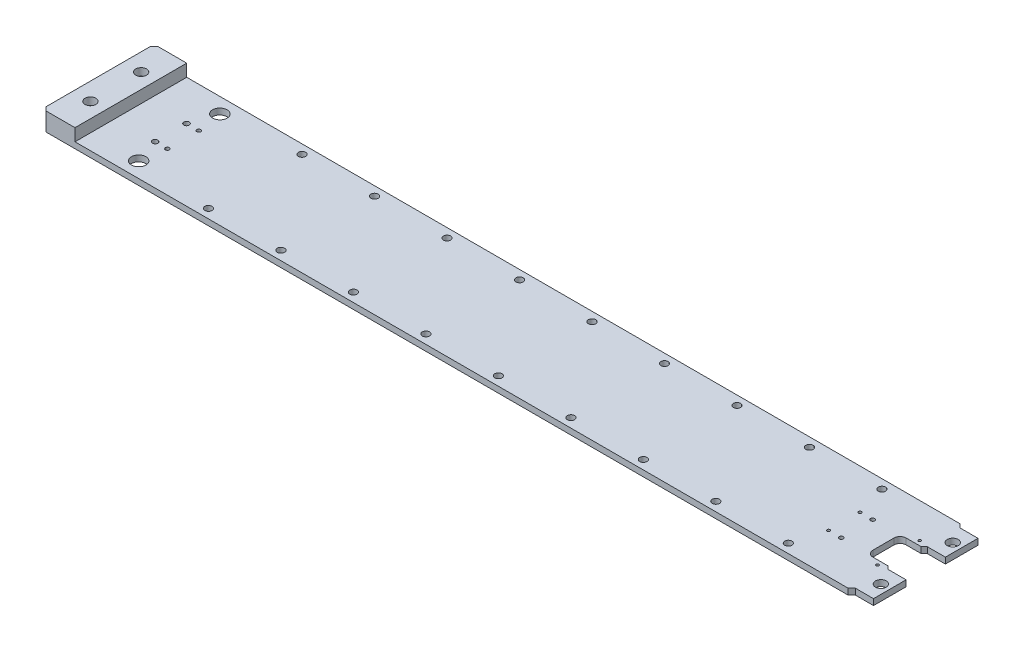
from build123d import *

# Parameters (mm, degrees)
SKETCH1_W                                       = 560
SKETCH1_H                                       = 185
BOSS_EXTRUDE1_DEPTH                             = 10
CBORE_FOR_M6_SOCKET_HEAD_CAP_SCREW1_D           = 6.6
CBORE_FOR_M6_SOCKET_HEAD_CAP_SCREW1_CBORE_D     = 11
CBORE_FOR_M6_SOCKET_HEAD_CAP_SCREW1_CBORE_DEPTH = 6
SKETCH4_W                                       = 40
SKETCH4_H                                       = 55
CUT_EXTRUDE1_DEPTH                              = 340.497422671
FILLET1_R                                       = 10
CHAMFER1_SIZE                                   = 5
CBORE_FOR_M4_SOCKET_HEAD_CAP_SCREW1_D           = 4.5
CBORE_FOR_M4_SOCKET_HEAD_CAP_SCREW1_CBORE_D     = 8
CBORE_FOR_M4_SOCKET_HEAD_CAP_SCREW1_CBORE_DEPTH = 5
M8X1_25_TAPPED_HOLE1_D                          = 6.8
M6X1_0_TAPPED_HOLE1_D                           = 5
M6X1_0_TAPPED_HOLE1_DEPTH                       = 17
M6X1_0_TAPPED_HOLE1_TIP                         = 1.502151548
CBORE_FOR_M5_SOCKET_HEAD_CAP_SCREW1_D           = 5.5
CBORE_FOR_M5_SOCKET_HEAD_CAP_SCREW1_CBORE_D     = 10
CBORE_FOR_M5_SOCKET_HEAD_CAP_SCREW1_CBORE_DEPTH = 5
LPATTERN2_COUNT                                 = 2
LPATTERN2_PITCH                                 = 250
LPATTERN2_COUNT_DIR2                            = 2
LPATTERN2_PITCH_DIR2                            = 100
SCALE1_SCALE                                    = 0.16666666
SKETCH17_W                                      = 30.8333321
SKETCH17_H                                      = 1.6666666
BOSS_EXTRUDE3_DEPTH                             = 130
CHAMFER2_SIZE                                   = 1
CUT_EXTRUDE3_REACH                              = 137.654
SKETCH19_R                                      = 0.74999997
CUT_EXTRUDE4_REACH                              = 137.654
SKETCH20_R                                      = 0.541666645
BOSS_EXTRUDE4_DEPTH                             = 3.38
SKETCH23_W                                      = 8.9999996
SKETCH23_H                                      = 1.6666666
BOSS_EXTRUDE5_DEPTH                             = 5
CUT_EXTRUDE5_REACH                              = 137.686
SKETCH24_R                                      = 1.5
CUT_EXTRUDE6_REACH                              = 137.738
SKETCH25_R                                      = 1.5
SKETCH26_R                                      = 2.75
CUT_EXTRUDE7_DEPTH                              = 3
SKETCH27_R                                      = 0.8333333
SKETCH27_R_2                                    = 0.41666665
SKETCH27_R_3                                    = 0.566666644
BOSS_EXTRUDE7_DEPTH                             = 1.6666666
SKETCH28_R                                      = 0.8333333
SKETCH28_R_2                                    = 0.91666663
BOSS_EXTRUDE8_DEPTH                             = 1.6666666
CUT_EXTRUDE8_REACH                              = 137.686
SKETCH29_R                                      = 1
BOSS_EXTRUDE9_START                             = -1.6666666
SKETCH31_R                                      = 1
BOSS_EXTRUDE9_DEPTH                             = 1.6666666
CUT_EXTRUDE9_REACH                              = 137.686
SKETCH33_R                                      = 2


with BuildPart() as part:
    # Sketch1 → Boss-Extrude1 (new body)
    with BuildSketch(Plane(origin=(0, 0, 0), x_dir=(1, 0, 0), z_dir=(0, 1, 0))):
        with Locations((46.5, 0)):
            Rectangle(SKETCH1_W, SKETCH1_H)
    extrude(amount=BOSS_EXTRUDE1_DEPTH)

    # CBORE for M6 Socket Head Cap Screw1 (through all)
    with Locations(Plane(origin=(0, 10, 0), x_dir=(-1, 0, 0), z_dir=(0, 1, 0))):
        with Locations((26, 44.5), (26, 64.5), (-26, 44.5), (-26, 64.5)):
            CounterBoreHole(CBORE_FOR_M6_SOCKET_HEAD_CAP_SCREW1_D / 2, CBORE_FOR_M6_SOCKET_HEAD_CAP_SCREW1_CBORE_D / 2, CBORE_FOR_M6_SOCKET_HEAD_CAP_SCREW1_CBORE_DEPTH)

    # Sketch4 → Cut-Extrude1 (cut, through all)
    with BuildSketch(Plane(origin=(0, 10, 0), x_dir=(1, 0, 0), z_dir=(0, 1, 0))):
        with Locations((306.5, 0)):
            Rectangle(SKETCH4_W, SKETCH4_H)
    extrude(amount=-CUT_EXTRUDE1_DEPTH, mode=Mode.SUBTRACT)

    # Fillet1
    fillet1_edges = [part.edges().sort_by_distance(p)[0] for p in [
        (286.5, 5, 27.5),
        (286.5, 5, -27.5),
    ]]
    fillet(fillet1_edges, radius=FILLET1_R)

    # Chamfer1
    chamfer1_edges = [part.edges().sort_by_distance(p)[0] for p in [
        (326.5, 5, -27.5),
        (326.5, 5, 27.5),
    ]]
    chamfer(chamfer1_edges, length=CHAMFER1_SIZE)

    # CBORE for M4 Socket Head Cap Screw1 (through all)
    with Locations(Plane.XZ):
        with Locations((311.5, 35), (311.5, -35)):
            CounterBoreHole(CBORE_FOR_M4_SOCKET_HEAD_CAP_SCREW1_D / 2, CBORE_FOR_M4_SOCKET_HEAD_CAP_SCREW1_CBORE_D / 2, CBORE_FOR_M4_SOCKET_HEAD_CAP_SCREW1_CBORE_DEPTH)

    # M8x1.25 Tapped Hole1 (through all)
    with Locations(Plane(origin=(0, 10, 0), x_dir=(-1, 0, 0), z_dir=(0, 1, 0))):
        with Locations((-242.5, 26), (-242.5, -26), (162, 26), (162, -26)):
            Hole(M8X1_25_TAPPED_HOLE1_D / 2)

    # M6x1.0 Tapped Hole1
    with Locations(Plane(origin=(0, 10, 0), x_dir=(-1, 0, 0), z_dir=(0, 1, 0))):
        with Locations((143, 26), (143, -26), (-221.5, 26), (-221.5, -26)):
            Hole(M6X1_0_TAPPED_HOLE1_D / 2, depth=M6X1_0_TAPPED_HOLE1_DEPTH)
            with Locations((0, 0, -(M6X1_0_TAPPED_HOLE1_DEPTH + M6X1_0_TAPPED_HOLE1_TIP / 2))):  # 118° drill point
                Cone(0, M6X1_0_TAPPED_HOLE1_D / 2, M6X1_0_TAPPED_HOLE1_TIP, mode=Mode.SUBTRACT)

    # CBORE for M5 Socket Head Cap Screw1 (through all)
    with Locations(Plane(origin=(0, 10, 0), x_dir=(-1, 0, 0), z_dir=(0, 1, 0))):
        with Locations((-109, 50), (-141, 50)):
            cbore_for_m5_socket_head_cap_screw1 = CounterBoreHole(CBORE_FOR_M5_SOCKET_HEAD_CAP_SCREW1_D / 2, CBORE_FOR_M5_SOCKET_HEAD_CAP_SCREW1_CBORE_D / 2, CBORE_FOR_M5_SOCKET_HEAD_CAP_SCREW1_CBORE_DEPTH)

    # Lpattern2: CBORE for M5 Socket Head Cap Screw1 2 × 2
    with Locations(*[(-i * LPATTERN2_PITCH, 0, -j * LPATTERN2_PITCH_DIR2) for i in range(LPATTERN2_COUNT) for j in range(LPATTERN2_COUNT_DIR2) if (i, j) != (0, 0)]):
        add(cbore_for_m5_socket_head_cap_screw1, mode=Mode.SUBTRACT)


with BuildPart() as part_1:
    # Scale1: scaled about (40.999570981, 4.992494178, -0.153467199)
    add(part.part.scale(SCALE1_SCALE).moved(Location((34.166309424, 4.160411848, -0.127889334))))

    # Sketch17 → Boss-Extrude3 (add)
    with BuildSketch(Plane.ZY.offset(4.750355686)):
        with Locations((-0.127889333, 4.993745148)):
            Rectangle(SKETCH17_W, SKETCH17_H)
    extrude(amount=BOSS_EXTRUDE3_DEPTH)

    # Chamfer2
    chamfer2_edges = [part_1.edges().sort_by_distance(p)[0] for p in [
        (-134.750355686, 4.993745148, -15.544555383),
        (-134.750355686, 4.993745148, 15.288776717),
        (88.582973914, 4.993745148, -15.544555384),
        (88.582973914, 4.993745148, 15.288776716),
    ]]
    chamfer(chamfer2_edges, length=CHAMFER2_SIZE)

    # Sketch19 → Cut-Extrude3 (cut, up to next)
    with BuildSketch(Plane(origin=(0, 5.827078448, 0), x_dir=(1, 0, 0), z_dir=(0, 1, 0)), mode=Mode.PRIVATE) as cut_extrude3_sk1:
        with Locations(Location((-114.723628525, -4.20516094, 0), (0, 0, 90))):
            Circle(SKETCH19_R)
    cut_extrude3_tool1 = extrude(cut_extrude3_sk1.sketch, amount=-CUT_EXTRUDE3_REACH, mode=Mode.PRIVATE) & part_1.part
    # Sketch19 → Cut-Extrude3 (cut, up to next)
    with BuildSketch(Plane(origin=(0, 5.827078448, 0), x_dir=(1, 0, 0), z_dir=(0, 1, 0)), mode=Mode.PRIVATE) as cut_extrude3_sk2:
        with Locations(Location((-114.723628525, 4.46150538, 0), (0, 0, 270))):
            Circle(SKETCH19_R)
    cut_extrude3_tool2 = extrude(cut_extrude3_sk2.sketch, amount=-CUT_EXTRUDE3_REACH, mode=Mode.PRIVATE) & part_1.part
    add(cut_extrude3_tool1.solids().sort_by_distance((-114.723629, 5.827078, 4.205161))[0], mode=Mode.SUBTRACT)
    add(cut_extrude3_tool2.solids().sort_by_distance((-114.723629, 5.827078, -4.461505))[0], mode=Mode.SUBTRACT)

    # Sketch20 → Cut-Extrude4 (cut, up to next)
    with BuildSketch(Plane(origin=(0, 5.827078448, 0), x_dir=(1, 0, 0), z_dir=(0, 1, 0)), mode=Mode.PRIVATE) as cut_extrude4_sk1:
        with Locations(Location((-111.3393435, 4.461222493, 0), (0, 0, 270))):
            Circle(SKETCH20_R)
    cut_extrude4_tool1 = extrude(cut_extrude4_sk1.sketch, amount=-CUT_EXTRUDE4_REACH, mode=Mode.PRIVATE) & part_1.part
    # Sketch20 → Cut-Extrude4 (cut, up to next)
    with BuildSketch(Plane(origin=(0, 5.827078448, 0), x_dir=(1, 0, 0), z_dir=(0, 1, 0)), mode=Mode.PRIVATE) as cut_extrude4_sk2:
        with Locations(Location((-111.3393435, -4.205443827, 0), (0, 0, 270))):
            Circle(SKETCH20_R)
    cut_extrude4_tool2 = extrude(cut_extrude4_sk2.sketch, amount=-CUT_EXTRUDE4_REACH, mode=Mode.PRIVATE) & part_1.part
    add(cut_extrude4_tool1.solids().sort_by_distance((-111.339344, 5.827078, -4.461222))[0], mode=Mode.SUBTRACT)
    add(cut_extrude4_tool2.solids().sort_by_distance((-111.339344, 5.827078, 4.205444))[0], mode=Mode.SUBTRACT)

    # Sketch22 → Boss-Extrude4 (add)
    with BuildSketch(Plane(origin=(0, 5.827078448, 0), x_dir=(1, 0, 0), z_dir=(0, 1, 0))):
        Polygon((-134.750355686, -14.288776717), (-133.750355686, -15.288776717), (-125.750355686, -15.288776717), (-125.750355686, 15.544555383), (-133.750355686, 15.544555383), (-134.750355686, 14.544555383), align=None)
    extrude(amount=BOSS_EXTRUDE4_DEPTH)

    # Sketch23 → Boss-Extrude5 (add)
    with BuildSketch(Plane(origin=(88.582973914, 0, 0), x_dir=(0, 0, -1), z_dir=(1, 0, 0))):
        with Locations((10.044555583, 4.993745148)):
            Rectangle(SKETCH23_W, SKETCH23_H)
        with Locations((-9.788776917, 4.993745148)):
            Rectangle(SKETCH23_W, SKETCH23_H)
    extrude(amount=BOSS_EXTRUDE5_DEPTH)

    # Sketch24 → Cut-Extrude5 (cut, up to next)
    with BuildSketch(Plane(origin=(0, 5.827078448, 0), x_dir=(1, 0, 0), z_dir=(0, 1, 0)), mode=Mode.PRIVATE) as cut_extrude5_sk1:
        with Locations(Location((91.109701075, 10.04483847, 0), (0, 0, 270))):
            Circle(SKETCH24_R)
    cut_extrude5_tool1 = extrude(cut_extrude5_sk1.sketch, amount=-CUT_EXTRUDE5_REACH, mode=Mode.PRIVATE) & part_1.part
    # Sketch24 → Cut-Extrude5 (cut, up to next)
    with BuildSketch(Plane(origin=(0, 5.827078448, 0), x_dir=(1, 0, 0), z_dir=(0, 1, 0)), mode=Mode.PRIVATE) as cut_extrude5_sk2:
        with Locations(Location((91.109701075, -9.78849403, 0), (0, 0, 270))):
            Circle(SKETCH24_R)
    cut_extrude5_tool2 = extrude(cut_extrude5_sk2.sketch, amount=-CUT_EXTRUDE5_REACH, mode=Mode.PRIVATE) & part_1.part
    add(cut_extrude5_tool1.solids().sort_by_distance((91.109701, 5.827078, -10.044838))[0], mode=Mode.SUBTRACT)
    add(cut_extrude5_tool2.solids().sort_by_distance((91.109701, 5.827078, 9.788494))[0], mode=Mode.SUBTRACT)

    # Sketch25 → Cut-Extrude6 (cut, up to next)
    with BuildSketch(Plane.XZ.offset(-4.160411848), mode=Mode.PRIVATE) as cut_extrude6_sk1:
        with Locations(Location((-129.908913611, -7.12817222, 0), (0, 0, 270))):
            Circle(SKETCH25_R)
    cut_extrude6_tool1 = extrude(cut_extrude6_sk1.sketch, amount=-CUT_EXTRUDE6_REACH, mode=Mode.PRIVATE) & part_1.part
    # Sketch25 → Cut-Extrude6 (cut, up to next)
    with BuildSketch(Plane.XZ.offset(-4.160411848), mode=Mode.PRIVATE) as cut_extrude6_sk2:
        with Locations(Location((-129.908913611, 6.87182778, 0), (0, 0, 270))):
            Circle(SKETCH25_R)
    cut_extrude6_tool2 = extrude(cut_extrude6_sk2.sketch, amount=-CUT_EXTRUDE6_REACH, mode=Mode.PRIVATE) & part_1.part
    add(cut_extrude6_tool1.solids().sort_by_distance((-129.908914, 4.160412, -7.128172))[0], mode=Mode.SUBTRACT)
    add(cut_extrude6_tool2.solids().sort_by_distance((-129.908914, 4.160412, 6.871828))[0], mode=Mode.SUBTRACT)

    # Sketch26 → Cut-Extrude7 (cut)
    with BuildSketch(Plane.XZ.offset(-4.160411848)):
        with Locations(Location((-129.908913611, -7.12817222, 0), (0, 0, 270))):
            Circle(SKETCH26_R)
        with Locations(Location((-129.908913611, 6.87182778, 0), (0, 0, 270))):
            Circle(SKETCH26_R)
    extrude(amount=-CUT_EXTRUDE7_DEPTH, mode=Mode.SUBTRACT)

    # Sketch27 → Boss-Extrude7 (add)
    with BuildSketch(Plane(origin=(0, 5.827078448, 0), x_dir=(1, 0, 0), z_dir=(0, 1, 0))):
        with Locations((15.999643484, -8.205443667)):
            Circle(SKETCH27_R)
        with Locations((10.666310364, -8.205443667)):
            Circle(SKETCH27_R)
        with Locations((10.332977044, -4.205443827)):
            Circle(SKETCH27_R_2)
        with Locations((7.166310504, -4.205443827)):
            Circle(SKETCH27_R_3)
        with Locations((7.166310504, 4.461222493)):
            Circle(SKETCH27_R_3)
        with Locations((10.332977044, 4.461222493)):
            Circle(SKETCH27_R_2)
        with Locations((10.666310364, 8.461222333)):
            Circle(SKETCH27_R)
        with Locations((15.999643484, 8.461222333)):
            Circle(SKETCH27_R)
    extrude(amount=-BOSS_EXTRUDE7_DEPTH)

    # Sketch28 → Boss-Extrude8 (add)
    with BuildSketch(Plane(origin=(0, 5.827078448, 0), x_dir=(1, 0, 0), z_dir=(0, 1, 0))):
        with Locations((57.666308484, 8.461222333)):
            Circle(SKETCH28_R)
        with Locations((52.332975364, 8.461222333)):
            Circle(SKETCH28_R)
        with Locations((57.666308484, -8.205443667)):
            Circle(SKETCH28_R)
        with Locations((52.332975364, -8.205443667)):
            Circle(SKETCH28_R)
        with Locations((29.832976264, -7.288777037)):
            Circle(SKETCH28_R_2)
        with Locations((29.832976264, -10.622110237)):
            Circle(SKETCH28_R_2)
        with Locations((38.499642584, -10.622110237)):
            Circle(SKETCH28_R_2)
        with Locations((38.499642584, -7.288777037)):
            Circle(SKETCH28_R_2)
    extrude(amount=-BOSS_EXTRUDE8_DEPTH)

    # Sketch29 → Cut-Extrude8 (cut, up to next)
    with BuildSketch(Plane(origin=(0, 5.827078448, 0), x_dir=(1, 0, 0), z_dir=(0, 1, 0)), mode=Mode.PRIVATE) as cut_extrude8_sk1:
        with Locations(Location((68.582973914, -12.788776717, 0), (0, 0, 270))):
            Circle(SKETCH29_R)
    cut_extrude8_tool1 = extrude(cut_extrude8_sk1.sketch, amount=-CUT_EXTRUDE8_REACH, mode=Mode.PRIVATE) & part_1.part
    # Sketch29 → Cut-Extrude8 (cut, up to next)
    with BuildSketch(Plane(origin=(0, 5.827078448, 0), x_dir=(1, 0, 0), z_dir=(0, 1, 0)), mode=Mode.PRIVATE) as cut_extrude8_sk2:
        with Locations(Location((48.582973914, -12.788776717, 0), (0, 0, 270))):
            Circle(SKETCH29_R)
    cut_extrude8_tool2 = extrude(cut_extrude8_sk2.sketch, amount=-CUT_EXTRUDE8_REACH, mode=Mode.PRIVATE) & part_1.part
    # Sketch29 → Cut-Extrude8 (cut, up to next)
    with BuildSketch(Plane(origin=(0, 5.827078448, 0), x_dir=(1, 0, 0), z_dir=(0, 1, 0)), mode=Mode.PRIVATE) as cut_extrude8_sk3:
        with Locations(Location((28.582973914, -12.788776717, 0), (0, 0, 270))):
            Circle(SKETCH29_R)
    cut_extrude8_tool3 = extrude(cut_extrude8_sk3.sketch, amount=-CUT_EXTRUDE8_REACH, mode=Mode.PRIVATE) & part_1.part
    # Sketch29 → Cut-Extrude8 (cut, up to next)
    with BuildSketch(Plane(origin=(0, 5.827078448, 0), x_dir=(1, 0, 0), z_dir=(0, 1, 0)), mode=Mode.PRIVATE) as cut_extrude8_sk4:
        with Locations(Location((8.582973914, -12.788776717, 0), (0, 0, 270))):
            Circle(SKETCH29_R)
    cut_extrude8_tool4 = extrude(cut_extrude8_sk4.sketch, amount=-CUT_EXTRUDE8_REACH, mode=Mode.PRIVATE) & part_1.part
    # Sketch29 → Cut-Extrude8 (cut, up to next)
    with BuildSketch(Plane(origin=(0, 5.827078448, 0), x_dir=(1, 0, 0), z_dir=(0, 1, 0)), mode=Mode.PRIVATE) as cut_extrude8_sk5:
        with Locations(Location((-11.417026086, -12.788776717, 0), (0, 0, 270))):
            Circle(SKETCH29_R)
    cut_extrude8_tool5 = extrude(cut_extrude8_sk5.sketch, amount=-CUT_EXTRUDE8_REACH, mode=Mode.PRIVATE) & part_1.part
    # Sketch29 → Cut-Extrude8 (cut, up to next)
    with BuildSketch(Plane(origin=(0, 5.827078448, 0), x_dir=(1, 0, 0), z_dir=(0, 1, 0)), mode=Mode.PRIVATE) as cut_extrude8_sk6:
        with Locations(Location((-31.417026086, -12.788776717, 0), (0, 0, 270))):
            Circle(SKETCH29_R)
    cut_extrude8_tool6 = extrude(cut_extrude8_sk6.sketch, amount=-CUT_EXTRUDE8_REACH, mode=Mode.PRIVATE) & part_1.part
    # Sketch29 → Cut-Extrude8 (cut, up to next)
    with BuildSketch(Plane(origin=(0, 5.827078448, 0), x_dir=(1, 0, 0), z_dir=(0, 1, 0)), mode=Mode.PRIVATE) as cut_extrude8_sk7:
        with Locations(Location((-51.417026086, -12.788776717, 0), (0, 0, 270))):
            Circle(SKETCH29_R)
    cut_extrude8_tool7 = extrude(cut_extrude8_sk7.sketch, amount=-CUT_EXTRUDE8_REACH, mode=Mode.PRIVATE) & part_1.part
    # Sketch29 → Cut-Extrude8 (cut, up to next)
    with BuildSketch(Plane(origin=(0, 5.827078448, 0), x_dir=(1, 0, 0), z_dir=(0, 1, 0)), mode=Mode.PRIVATE) as cut_extrude8_sk8:
        with Locations(Location((-71.417026086, -12.788776717, 0), (0, 0, 270))):
            Circle(SKETCH29_R)
    cut_extrude8_tool8 = extrude(cut_extrude8_sk8.sketch, amount=-CUT_EXTRUDE8_REACH, mode=Mode.PRIVATE) & part_1.part
    # Sketch29 → Cut-Extrude8 (cut, up to next)
    with BuildSketch(Plane(origin=(0, 5.827078448, 0), x_dir=(1, 0, 0), z_dir=(0, 1, 0)), mode=Mode.PRIVATE) as cut_extrude8_sk9:
        with Locations(Location((-91.417026086, -12.788776717, 0), (0, 0, 270))):
            Circle(SKETCH29_R)
    cut_extrude8_tool9 = extrude(cut_extrude8_sk9.sketch, amount=-CUT_EXTRUDE8_REACH, mode=Mode.PRIVATE) & part_1.part
    # Sketch29 → Cut-Extrude8 (cut, up to next)
    with BuildSketch(Plane(origin=(0, 5.827078448, 0), x_dir=(1, 0, 0), z_dir=(0, 1, 0)), mode=Mode.PRIVATE) as cut_extrude8_sk10:
        with Locations(Location((-111.417026086, -12.788776717, 0), (0, 0, 270))):
            Circle(SKETCH29_R)
    cut_extrude8_tool10 = extrude(cut_extrude8_sk10.sketch, amount=-CUT_EXTRUDE8_REACH, mode=Mode.PRIVATE) & part_1.part
    # Sketch29 → Cut-Extrude8 (cut, up to next)
    with BuildSketch(Plane(origin=(0, 5.827078448, 0), x_dir=(1, 0, 0), z_dir=(0, 1, 0)), mode=Mode.PRIVATE) as cut_extrude8_sk11:
        with Locations(Location((68.582973914, 13.044555383, 0), (0, 0, 90))):
            Circle(SKETCH29_R)
    cut_extrude8_tool11 = extrude(cut_extrude8_sk11.sketch, amount=-CUT_EXTRUDE8_REACH, mode=Mode.PRIVATE) & part_1.part
    # Sketch29 → Cut-Extrude8 (cut, up to next)
    with BuildSketch(Plane(origin=(0, 5.827078448, 0), x_dir=(1, 0, 0), z_dir=(0, 1, 0)), mode=Mode.PRIVATE) as cut_extrude8_sk12:
        with Locations(Location((48.582973914, 13.044555383, 0), (0, 0, 90))):
            Circle(SKETCH29_R)
    cut_extrude8_tool12 = extrude(cut_extrude8_sk12.sketch, amount=-CUT_EXTRUDE8_REACH, mode=Mode.PRIVATE) & part_1.part
    # Sketch29 → Cut-Extrude8 (cut, up to next)
    with BuildSketch(Plane(origin=(0, 5.827078448, 0), x_dir=(1, 0, 0), z_dir=(0, 1, 0)), mode=Mode.PRIVATE) as cut_extrude8_sk13:
        with Locations(Location((28.582973914, 13.044555383, 0), (0, 0, 90))):
            Circle(SKETCH29_R)
    cut_extrude8_tool13 = extrude(cut_extrude8_sk13.sketch, amount=-CUT_EXTRUDE8_REACH, mode=Mode.PRIVATE) & part_1.part
    # Sketch29 → Cut-Extrude8 (cut, up to next)
    with BuildSketch(Plane(origin=(0, 5.827078448, 0), x_dir=(1, 0, 0), z_dir=(0, 1, 0)), mode=Mode.PRIVATE) as cut_extrude8_sk14:
        with Locations(Location((8.582973914, 13.044555383, 0), (0, 0, 90))):
            Circle(SKETCH29_R)
    cut_extrude8_tool14 = extrude(cut_extrude8_sk14.sketch, amount=-CUT_EXTRUDE8_REACH, mode=Mode.PRIVATE) & part_1.part
    # Sketch29 → Cut-Extrude8 (cut, up to next)
    with BuildSketch(Plane(origin=(0, 5.827078448, 0), x_dir=(1, 0, 0), z_dir=(0, 1, 0)), mode=Mode.PRIVATE) as cut_extrude8_sk15:
        with Locations(Location((-11.417026086, 13.044555383, 0), (0, 0, 90))):
            Circle(SKETCH29_R)
    cut_extrude8_tool15 = extrude(cut_extrude8_sk15.sketch, amount=-CUT_EXTRUDE8_REACH, mode=Mode.PRIVATE) & part_1.part
    # Sketch29 → Cut-Extrude8 (cut, up to next)
    with BuildSketch(Plane(origin=(0, 5.827078448, 0), x_dir=(1, 0, 0), z_dir=(0, 1, 0)), mode=Mode.PRIVATE) as cut_extrude8_sk16:
        with Locations(Location((-31.417026086, 13.044555383, 0), (0, 0, 90))):
            Circle(SKETCH29_R)
    cut_extrude8_tool16 = extrude(cut_extrude8_sk16.sketch, amount=-CUT_EXTRUDE8_REACH, mode=Mode.PRIVATE) & part_1.part
    # Sketch29 → Cut-Extrude8 (cut, up to next)
    with BuildSketch(Plane(origin=(0, 5.827078448, 0), x_dir=(1, 0, 0), z_dir=(0, 1, 0)), mode=Mode.PRIVATE) as cut_extrude8_sk17:
        with Locations(Location((-51.417026086, 13.044555383, 0), (0, 0, 90))):
            Circle(SKETCH29_R)
    cut_extrude8_tool17 = extrude(cut_extrude8_sk17.sketch, amount=-CUT_EXTRUDE8_REACH, mode=Mode.PRIVATE) & part_1.part
    # Sketch29 → Cut-Extrude8 (cut, up to next)
    with BuildSketch(Plane(origin=(0, 5.827078448, 0), x_dir=(1, 0, 0), z_dir=(0, 1, 0)), mode=Mode.PRIVATE) as cut_extrude8_sk18:
        with Locations(Location((-71.417026086, 13.044555383, 0), (0, 0, 90))):
            Circle(SKETCH29_R)
    cut_extrude8_tool18 = extrude(cut_extrude8_sk18.sketch, amount=-CUT_EXTRUDE8_REACH, mode=Mode.PRIVATE) & part_1.part
    # Sketch29 → Cut-Extrude8 (cut, up to next)
    with BuildSketch(Plane(origin=(0, 5.827078448, 0), x_dir=(1, 0, 0), z_dir=(0, 1, 0)), mode=Mode.PRIVATE) as cut_extrude8_sk19:
        with Locations(Location((-91.417026086, 13.044555383, 0), (0, 0, 90))):
            Circle(SKETCH29_R)
    cut_extrude8_tool19 = extrude(cut_extrude8_sk19.sketch, amount=-CUT_EXTRUDE8_REACH, mode=Mode.PRIVATE) & part_1.part
    # Sketch29 → Cut-Extrude8 (cut, up to next)
    with BuildSketch(Plane(origin=(0, 5.827078448, 0), x_dir=(1, 0, 0), z_dir=(0, 1, 0)), mode=Mode.PRIVATE) as cut_extrude8_sk20:
        with Locations(Location((-111.417026086, 13.044555383, 0), (0, 0, 90))):
            Circle(SKETCH29_R)
    cut_extrude8_tool20 = extrude(cut_extrude8_sk20.sketch, amount=-CUT_EXTRUDE8_REACH, mode=Mode.PRIVATE) & part_1.part
    add(cut_extrude8_tool1.solids().sort_by_distance((68.582974, 5.827078, 12.788777))[0], mode=Mode.SUBTRACT)
    add(cut_extrude8_tool2.solids().sort_by_distance((48.582974, 5.827078, 12.788777))[0], mode=Mode.SUBTRACT)
    add(cut_extrude8_tool3.solids().sort_by_distance((28.582974, 5.827078, 12.788777))[0], mode=Mode.SUBTRACT)
    add(cut_extrude8_tool4.solids().sort_by_distance((8.582974, 5.827078, 12.788777))[0], mode=Mode.SUBTRACT)
    add(cut_extrude8_tool5.solids().sort_by_distance((-11.417026, 5.827078, 12.788777))[0], mode=Mode.SUBTRACT)
    add(cut_extrude8_tool6.solids().sort_by_distance((-31.417026, 5.827078, 12.788777))[0], mode=Mode.SUBTRACT)
    add(cut_extrude8_tool7.solids().sort_by_distance((-51.417026, 5.827078, 12.788777))[0], mode=Mode.SUBTRACT)
    add(cut_extrude8_tool8.solids().sort_by_distance((-71.417026, 5.827078, 12.788777))[0], mode=Mode.SUBTRACT)
    add(cut_extrude8_tool9.solids().sort_by_distance((-91.417026, 5.827078, 12.788777))[0], mode=Mode.SUBTRACT)
    add(cut_extrude8_tool10.solids().sort_by_distance((-111.417026, 5.827078, 12.788777))[0], mode=Mode.SUBTRACT)
    add(cut_extrude8_tool11.solids().sort_by_distance((68.582974, 5.827078, -13.044555))[0], mode=Mode.SUBTRACT)
    add(cut_extrude8_tool12.solids().sort_by_distance((48.582974, 5.827078, -13.044555))[0], mode=Mode.SUBTRACT)
    add(cut_extrude8_tool13.solids().sort_by_distance((28.582974, 5.827078, -13.044555))[0], mode=Mode.SUBTRACT)
    add(cut_extrude8_tool14.solids().sort_by_distance((8.582974, 5.827078, -13.044555))[0], mode=Mode.SUBTRACT)
    add(cut_extrude8_tool15.solids().sort_by_distance((-11.417026, 5.827078, -13.044555))[0], mode=Mode.SUBTRACT)
    add(cut_extrude8_tool16.solids().sort_by_distance((-31.417026, 5.827078, -13.044555))[0], mode=Mode.SUBTRACT)
    add(cut_extrude8_tool17.solids().sort_by_distance((-51.417026, 5.827078, -13.044555))[0], mode=Mode.SUBTRACT)
    add(cut_extrude8_tool18.solids().sort_by_distance((-71.417026, 5.827078, -13.044555))[0], mode=Mode.SUBTRACT)
    add(cut_extrude8_tool19.solids().sort_by_distance((-91.417026, 5.827078, -13.044555))[0], mode=Mode.SUBTRACT)
    add(cut_extrude8_tool20.solids().sort_by_distance((-111.417026, 5.827078, -13.044555))[0], mode=Mode.SUBTRACT)

    # Sketch31 → Boss-Extrude9 (add)
    with BuildSketch(Plane.XZ.offset(-4.160411848).offset(BOSS_EXTRUDE9_START)):
        with Locations((-111.417026086, 12.788776717)):
            Circle(SKETCH31_R)
        with Locations((-111.417026086, -13.044555383)):
            Circle(SKETCH31_R)
    extrude(amount=BOSS_EXTRUDE9_DEPTH)

    # Sketch33 → Cut-Extrude9 (cut, up to next)
    with BuildSketch(Plane(origin=(0, 5.827078448, 0), x_dir=(1, 0, 0), z_dir=(0, 1, 0)), mode=Mode.PRIVATE) as cut_extrude9_sk1:
        with Locations(Location((-112.417026086, -11.055444617, 0), (0, 0, 270))):
            Circle(SKETCH33_R)
    cut_extrude9_tool1 = extrude(cut_extrude9_sk1.sketch, amount=-CUT_EXTRUDE9_REACH, mode=Mode.PRIVATE) & part_1.part
    # Sketch33 → Cut-Extrude9 (cut, up to next)
    with BuildSketch(Plane(origin=(0, 5.827078448, 0), x_dir=(1, 0, 0), z_dir=(0, 1, 0)), mode=Mode.PRIVATE) as cut_extrude9_sk2:
        with Locations(Location((-112.417026086, 11.344555383, 0), (0, 0, 270))):
            Circle(SKETCH33_R)
    cut_extrude9_tool2 = extrude(cut_extrude9_sk2.sketch, amount=-CUT_EXTRUDE9_REACH, mode=Mode.PRIVATE) & part_1.part
    add(cut_extrude9_tool1.solids().sort_by_distance((-112.417026, 5.827078, 11.055445))[0], mode=Mode.SUBTRACT)
    add(cut_extrude9_tool2.solids().sort_by_distance((-112.417026, 5.827078, -11.344555))[0], mode=Mode.SUBTRACT)


solid = part_1.part
